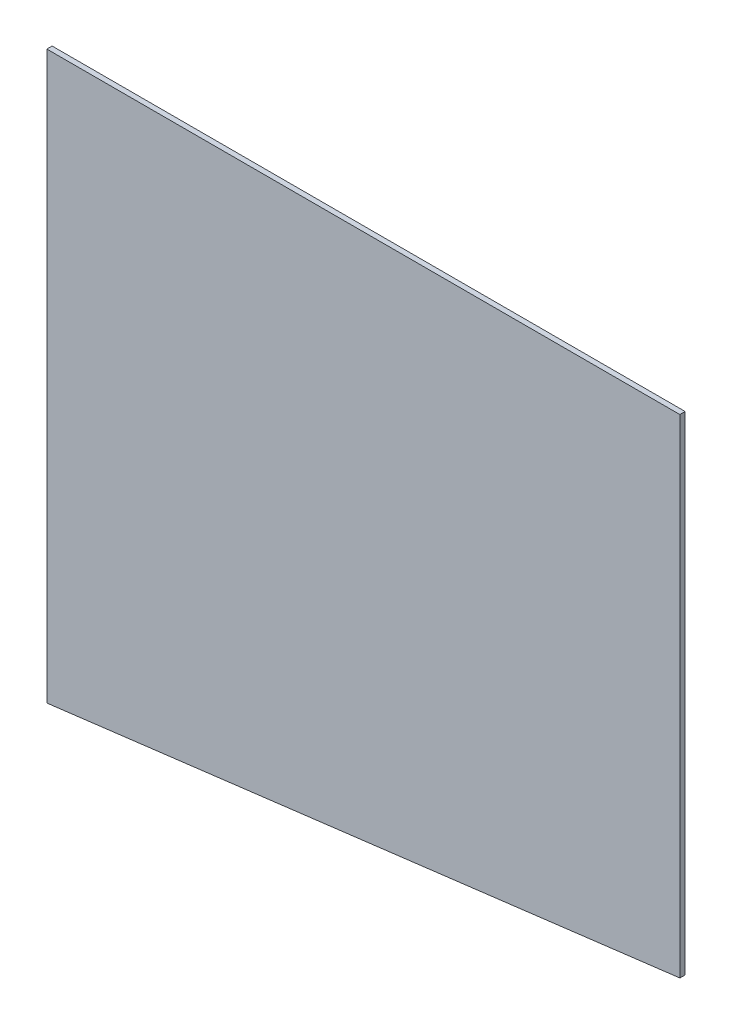
from build123d import *

# Parameters (mm, degrees)
BOSS_EXTRUDE1_DEPTH = 2


with BuildPart() as part:
    # Sketch1 → Boss-Extrude1 (new body)
    with BuildSketch(Plane.XY):
        Polygon((299.490005303, -216.429379744), (59.490005303, -216.429379744), (59.490005303, -431.155431781), (299.490005303, -401.429379744), align=None)
    extrude(amount=BOSS_EXTRUDE1_DEPTH)


solid = part.part
